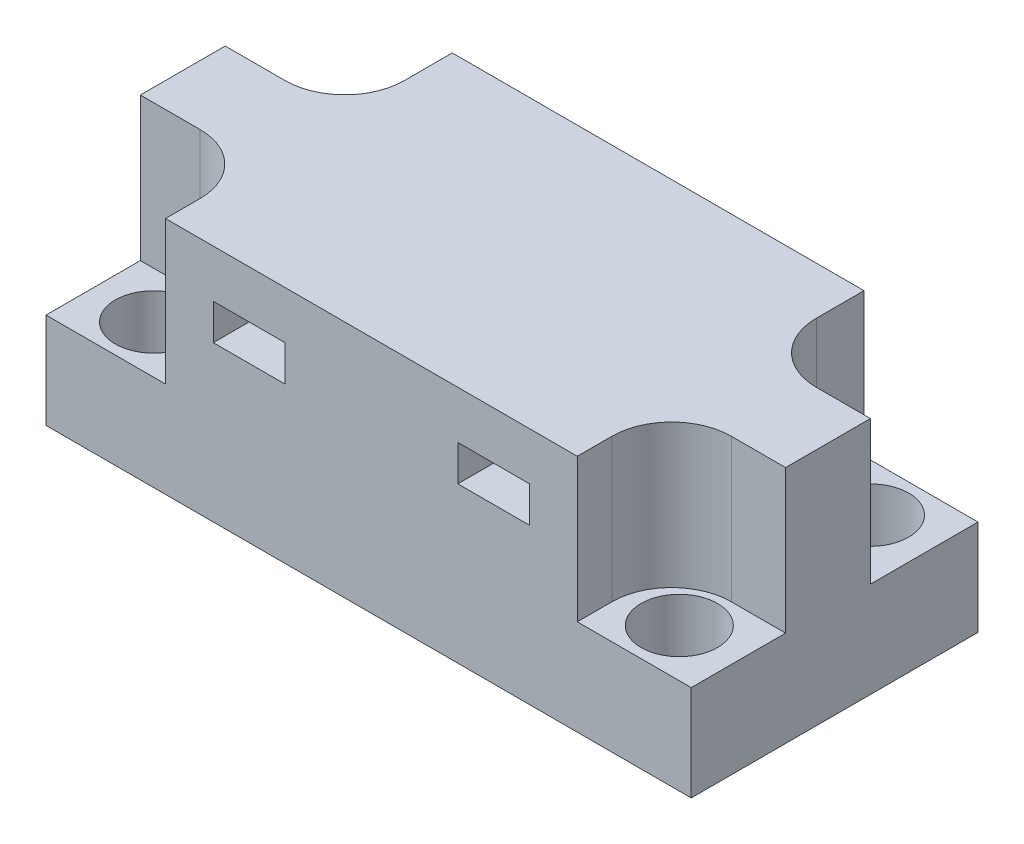
from build123d import *

# Parameters (mm, degrees)
SKETCH_1_W          = 27000
SKETCH_1_H          = 12000
SKETCH_1_R          = 1600
EXTRUDE_1_DEPTH     = 10000
CUT_EXTRUDE_3_DEPTH = 6000
SKETCH_5_W          = 3000
SKETCH_5_H          = 1500
CUT_EXTRUDE_4_DEPTH = 20646.822822063


with BuildPart() as part:
    # 草圖1 → 填料-伸長1 (new body)
    with BuildSketch(Plane(origin=(0, 0, 0), x_dir=(1, 0, 0), z_dir=(0, 1, 0))):
        Rectangle(SKETCH_1_W, SKETCH_1_H)
        with Locations(Location((-11000, 4000, 0), (0, 0, 270))):
            Circle(SKETCH_1_R, mode=Mode.SUBTRACT)
        with Locations(Location((11000, 4000, 0), (0, 0, 270))):
            Circle(SKETCH_1_R, mode=Mode.SUBTRACT)
        with Locations(Location((-11000, -4000, 0), (0, 0, 270))):
            Circle(SKETCH_1_R, mode=Mode.SUBTRACT)
        with Locations(Location((11000, -4000, 0), (0, 0, 270))):
            Circle(SKETCH_1_R, mode=Mode.SUBTRACT)
    extrude(amount=EXTRUDE_1_DEPTH)

    # 草圖3 → 除料-伸長3 (cut)
    with BuildSketch(Plane(origin=(0, 10000, 0), x_dir=(1, 0, 0), z_dir=(0, 1, 0))):
        with BuildLine():
            Line((-11000, 6500), (-13500, 6500))
            Line((-13500, 6500), (-13500, 4000))
            Line((-13500, 4000), (-13500, 1500))
            Line((-13500, 1500), (-11000, 1500))
            ThreePointArc((-11000, 1500), (-9232.233047034, 2232.233047034), (-8500, 4000))
            Line((-8500, 4000), (-8500, 6500))
            Line((-8500, 6500), (-11000, 6500))
        make_face()
        with BuildLine():
            Line((13731.794950486, 1500), (11231.794950486, 1500))
            ThreePointArc((11231.794950486, 1500), (9464.02799752, 2232.233047034), (8731.794950486, 4000))
            Line((8731.794950486, 4000), (8731.794950486, 6500))
            Line((8731.794950486, 6500), (11231.794950486, 6500))
            Line((11231.794950486, 6500), (13731.794950486, 6500))
            Line((13731.794950486, 6500), (13731.794950486, 4000))
            Line((13731.794950486, 4000), (13731.794950486, 1500))
        make_face()
        with BuildLine():
            Line((11231.794950486, -7052.117551123), (13731.794950486, -7052.117551123))
            Line((13731.794950486, -7052.117551123), (13731.794950486, -4552.117551123))
            Line((13731.794950486, -4552.117551123), (13731.794950486, -2052.117551123))
            Line((13731.794950486, -2052.117551123), (11231.794950486, -2052.117551123))
            ThreePointArc((11231.794950486, -2052.117551123), (9464.02799752, -2784.350598156), (8731.794950486, -4552.117551123))
            Line((8731.794950486, -4552.117551123), (8731.794950486, -7052.117551123))
            Line((8731.794950486, -7052.117551123), (11231.794950486, -7052.117551123))
        make_face()
        with BuildLine():
            Line((-13500, -2052.117551123), (-11000, -2052.117551123))
            ThreePointArc((-11000, -2052.117551123), (-9232.233047034, -2784.350598156), (-8500, -4552.117551123))
            Line((-8500, -4552.117551123), (-8500, -7052.117551123))
            Line((-8500, -7052.117551123), (-11000, -7052.117551123))
            Line((-11000, -7052.117551123), (-13500, -7052.117551123))
            Line((-13500, -7052.117551123), (-13500, -4552.117551123))
            Line((-13500, -4552.117551123), (-13500, -2052.117551123))
        make_face()
    extrude(amount=-CUT_EXTRUDE_3_DEPTH, mode=Mode.SUBTRACT)

    # 草圖5 → 除料-伸長4 (cut, through all)
    with BuildSketch(Plane.XY.offset(6000)):
        with Locations((-5000, 7250)):
            Rectangle(SKETCH_5_W, SKETCH_5_H)
        with Locations((5231.794950486, 7250)):
            Rectangle(SKETCH_5_W, SKETCH_5_H)
    extrude(amount=-CUT_EXTRUDE_4_DEPTH, mode=Mode.SUBTRACT)


solid = part.part
